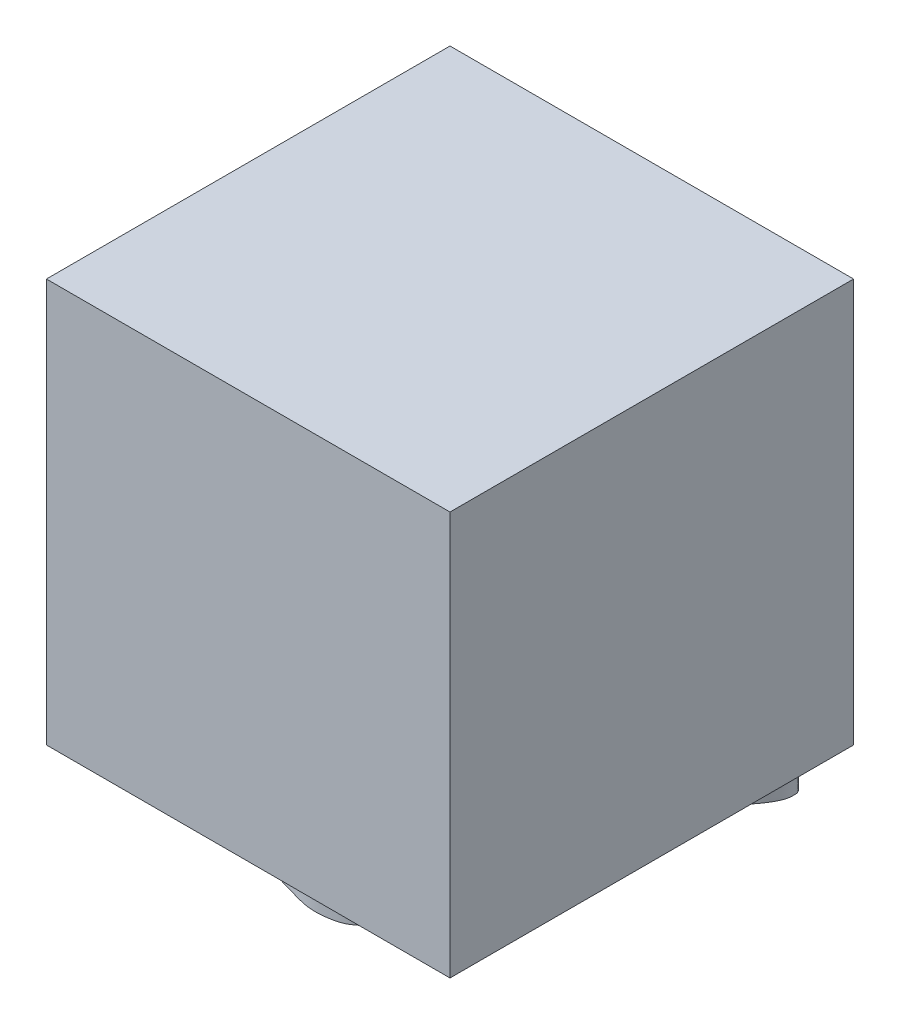
from build123d import *

# Parameters (mm, degrees)
SKETCH_1_W      = 30
SKETCH_1_H      = 30
EXTRUDE_1_DEPTH = 30
EXTRUDE_2_DEPTH = 2


with BuildPart() as part:
    # 草图1 → 凸台-拉伸1 (new body)
    with BuildSketch(Plane(origin=(0, 0, 0), x_dir=(1, 0, 0), z_dir=(0, 1, 0))):
        Rectangle(SKETCH_1_W, SKETCH_1_H)
    extrude(amount=EXTRUDE_1_DEPTH)

    # 草图2 → 凸台-拉伸2 (add)
    with BuildSketch(Plane.XZ):
        with BuildLine():
            add(Edge.make_bspline(
                [(-0.413139507, 12.660249476), (-0.778261096, 12.490955268), (-1.775190195, 11.968904426), (-3.617645227, 11.620705906), (-5.429874837, 11.07144813), (-6.717860152, 10.852505359), (-7.535830981, 11.0254314), (-7.924903013, 10.400481393), (-7.477306177, 9.706186914), (-7.384668414, 8.843700973), (-6.873971011, 7.869907633), (-7.160319356, 6.875523209), (-7.294004446, 5.704246833), (-7.421277648, 4.264169233), (-7.707467224, 2.062321345), (-8.464152297, -1.216837427), (-9.416270532, -4.964154879), (-11.175158435, -8.955848582), (-12.277523791, -11.407219371), (-14.050084255, -12.485011226), (-13.933043988, -12.779768339), (-13.744557421, -12.97250106), (-13.393667558, -12.986420113), (-12.873741383, -12.899604139), (-12.116553141, -12.860937947), (-11.452310478, -12.244644168), (-10.31472738, -11.595554765), (-9.299136585, -10.156201929), (-7.986863801, -8.015821769), (-6.57297794, -5.258138303), (-5.831005868, -2.127270842), (-5.021884261, 0.004287598), (-4.933731925, 1.059336537), (-4.826706465, 1.323611228), (-4.598443234, 1.437232013), (-4.288250478, 1.411645284), (-3.943360214, 1.324520016), (-3.423001508, 1.180348592), (-3.246030566, 0.412709608), (-3.327881363, -0.300948231), (-3.356625482, -1.256490572), (-3.332595796, -2.551860981), (-3.602712128, -4.207022278), (-3.840098598, -5.835024868), (-4.219266493, -7.412610964), (-4.242330279, -8.915857407), (-4.369111397, -10.641593174), (-3.65190849, -11.990229453), (-2.809848226, -12.969581743), (-1.809625327, -13.637359623), (-0.496248558, -14.017074175), (0.567461897, -13.370260365), (1.628053828, -12.925543641), (1.467709085, -11.8264544), (2.274562545, -11.231570985), (2.771920695, -10.368096577), (3.447723159, -9.538536039), (3.982566975, -8.502186189), (4.518942407, -7.551184452), (4.693569353, -6.852226616), (5.043758211, -6.296560663), (5.437210276, -6.755476757), (5.784275685, -7.159692505), (6.647106622, -7.855017156), (7.829613196, -8.76416631), (9.359437859, -9.862540225), (11.028167704, -10.92694032), (12.388237014, -11.697156931), (13.365252981, -12.178241135), (13.976813354, -12.054218893), (14.040955189, -11.439090613), (13.915520663, -10.789468662), (13.486146081, -10.069138366), (13.018870968, -9.363649713), (11.835939267, -8.555574207), (10.566078631, -7.923630982), (9.100096794, -7.040043518), (8.006972881, -6.471280922), (6.789728892, -5.880491964), (6.126347212, -5.361075412), (4.959389532, -5.192703557), (5.479367745, -4.663759847), (5.970560699, -4.32460495), (6.897554288, -3.673930211), (7.997369225, -3.027373773), (9.030812636, -2.00935725), (9.897572996, -0.733261854), (10.499725939, 0.689215867), (9.895977969, 1.894282537), (9.032794377, 2.262260531), (8.046405185, 2.524690213), (7.057401257, 2.581932255), (6.247565966, 2.077763608), (5.74833638, 1.875059682), (5.152031714, 1.641911431), (5.633877884, 1.273737748), (5.975235716, 1.52898326), (6.34735299, 1.556525328), (6.709283818, 1.602138733), (7.071938285, 1.325080522), (7.154943666, 0.781921106), (7.042925909, 0.30981302), (6.541281332, -0.446338426), (5.521793312, -1.075977418), (3.942896108, -2.089511767), (1.89707893, -3.167996126), (0.876238832, -3.368522062), (-0.422809067, -4.163002543), (-0.404542403, -3.87710227), (-0.803217489, -3.897289846), (-0.656049428, -3.576177333), (-0.714875183, -3.323507322), (-0.661354465, -3.021910676), (-0.666268065, -2.724403129), (-0.635125688, -2.376489367), (-0.703207239, -1.916544564), (-0.553324851, -1.410460204), (-0.739968821, -0.95013231), (-1.049137571, -0.433243486), (-1.260611128, 0.140020331), (-1.737553109, 0.610160501), (-2.031039017, 0.865178836), (-2.373543564, 0.999871969), (-2.380434771, 1.173000051), (-2.320724314, 1.31534508), (-2.052318002, 1.451602543), (-1.654877459, 1.494445113), (-1.238579515, 1.722878478), (-0.739146377, 1.813731033), (-0.270028582, 2.002120631), (0.243788374, 2.099306526), (0.826781083, 2.24466196), (1.613408038, 2.448291354), (2.618971353, 2.768447231), (3.983058836, 3.11275807), (5.59477303, 3.488219753), (7.122845708, 3.872937214), (8.504621829, 3.879564133), (9.252468882, 4.222641343), (9.866574989, 4.446828975), (9.919854908, 4.72296331), (9.771305632, 4.930917443), (9.52654699, 5.097217777), (9.173524259, 5.495610484), (8.555844613, 5.570095588), (7.892411431, 5.897522895), (6.976885941, 5.890709642), (6.074067802, 6.16275076), (5.283495217, 5.766787087), (4.601169154, 5.761989446), (3.679753202, 5.284922821), (2.641788543, 5.12866473), (1.242488794, 4.623993771), (0.013157214, 4.469816859), (-1.20124589, 3.953506124), (-2.192760949, 3.768000087), (-3.125774741, 3.36322373), (-3.773007457, 3.139081911), (-4.121562022, 3.058967527), (-4.259342576, 3.119080471), (-4.355820286, 3.211495205), (-4.448304693, 3.355017291), (-4.45471175, 3.667676474), (-4.477622379, 4.084730178), (-4.364277115, 4.603350313), (-4.374550283, 5.114969803), (-4.27557901, 5.624383048), (-4.207873507, 6.050972601), (-4.089449768, 6.292778489), (-4.067235965, 6.454201992), (-3.961381674, 6.442580572), (-3.788052058, 6.535547523), (-3.541718758, 6.385410503), (-3.218718969, 6.449186679), (-2.910839141, 6.256546464), (-2.485550157, 6.372781007), (-2.071071829, 6.188271877), (-1.636090735, 6.250606578), (-1.200782155, 6.163446555), (-0.657565868, 6.058245847), (0.029757843, 6.068779058), (0.790437633, 6.1634305), (1.786272463, 6.242867945), (3.291175791, 6.406836637), (5.540688758, 6.817070819), (7.620485762, 7.466863799), (8.674422461, 8.484669317), (8.775962223, 8.968671554), (8.589535538, 9.200615937), (8.351140841, 9.514736892), (7.916875238, 9.882267546), (7.294816123, 10.060486364), (6.398934994, 10.237318084), (5.341335365, 10.132980834), (3.915068945, 9.915091235), (2.096978192, 9.254612397), (0.06971382, 8.382654832), (-1.914076049, 7.903639645), (-3.015040534, 7.529846337), (-3.691385789, 7.420020544), (-3.951804349, 7.631280816), (-4.078454067, 7.846192489), (-4.167051414, 8.159754439), (-4.183663808, 8.513669074), (-4.21126222, 8.92394897), (-4.225677442, 9.380793519), (-4.562467322, 9.671047371), (-4.810469436, 9.879598003), (-4.973547655, 10.032225982), (-4.947277714, 10.292295204), (-4.61635402, 10.332982338), (-4.210054612, 10.193217911), (-3.69657785, 10.106129644), (-3.188153602, 10.0012354), (-2.663481676, 9.909369761), (-1.652809502, 9.801554359), (-0.477186979, 9.896369339), (0.933586865, 10.140283458), (2.208260982, 10.491377912), (4.02001539, 10.857230536), (5.483352038, 11.41556514), (6.469020229, 12.326193463), (6.387698048, 12.858929054), (6.035914881, 13.15342118), (5.495181719, 13.495497514), (4.502482332, 13.720454343), (3.055509861, 13.809807787), (1.594209656, 13.301654653), (0.36951905, 13.004085061), (-0.2040422, 12.75720064), (-0.413139507, 12.660249476)],
                knots=[0, 0, 0, 0, 0.005626061, 0.015694521, 0.026033351, 0.032086213, 0.034130702, 0.036852638, 0.039956627, 0.044843127, 0.049045535, 0.054701236, 0.05851792, 0.065709321, 0.074889623, 0.089625909, 0.11279458, 0.129064012, 0.150062865, 0.152160336, 0.153130122, 0.153997525, 0.155862947, 0.157612747, 0.161562635, 0.165985541, 0.169813161, 0.179891994, 0.189850356, 0.205303502, 0.222860236, 0.234937007, 0.236802428, 0.237716751, 0.238769217, 0.240098134, 0.24198306, 0.243862434, 0.247165407, 0.251460051, 0.25432416, 0.26045848, 0.269625682, 0.277709174, 0.283543137, 0.292253836, 0.298797, 0.307350322, 0.312707118, 0.316761448, 0.324279638, 0.329823371, 0.334220211, 0.338390167, 0.342748815, 0.347145655, 0.352421863, 0.357595066, 0.363629773, 0.367027872, 0.368836407, 0.370513013, 0.373552364, 0.377178091, 0.38556112, 0.394723191, 0.403457252, 0.413296854, 0.416626611, 0.418663418, 0.42067181, 0.424201146, 0.428133799, 0.432222777, 0.435943803, 0.447938526, 0.452198969, 0.459835758, 0.465506221, 0.470215208, 0.473964213, 0.475273324, 0.478769939, 0.48310816, 0.490763399, 0.496763374, 0.503086434, 0.51285569, 0.515736172, 0.521048894, 0.525164618, 0.530276863, 0.534346629, 0.537688915, 0.539163217, 0.540904037, 0.542912429, 0.544677097, 0.546108239, 0.547866975, 0.550395868, 0.553346244, 0.554482954, 0.563033068, 0.569415346, 0.58157619, 0.591427608, 0.593423505, 0.593525729, 0.595227083, 0.596044986, 0.597436626, 0.59896408, 0.600224639, 0.601617422, 0.603837797, 0.606686446, 0.608648943, 0.610550576, 0.615192323, 0.616985243, 0.619773525, 0.620956421, 0.621380126, 0.622050062, 0.623014616, 0.625368995, 0.627646884, 0.629532091, 0.632441851, 0.634692888, 0.636840972, 0.640861668, 0.646072993, 0.651619616, 0.660564653, 0.66925972, 0.673692486, 0.679503508, 0.681144846, 0.682039979, 0.68298464, 0.684524158, 0.686217765, 0.690240174, 0.692689678, 0.696495613, 0.702923448, 0.704934653, 0.708582735, 0.712218307, 0.719226501, 0.723148425, 0.733024003, 0.736362109, 0.741561127, 0.747078169, 0.750496328, 0.75127615, 0.751943279, 0.752491206, 0.753144534, 0.754270181, 0.756747835, 0.759029809, 0.761635951, 0.763861104, 0.766340307, 0.767486222, 0.767848724, 0.768292157, 0.768683909, 0.770593572, 0.771615605, 0.773173094, 0.775279101, 0.777368647, 0.779257858, 0.781290158, 0.783550806, 0.787005067, 0.790847073, 0.794298741, 0.800998796, 0.812023881, 0.826485034, 0.830625387, 0.83183958, 0.832854077, 0.834571205, 0.837478163, 0.840563595, 0.843522065, 0.850248481, 0.855243314, 0.863744527, 0.877181842, 0.886230424, 0.892016225, 0.893905691, 0.895212712, 0.896407795, 0.897377826, 0.899744602, 0.901326837, 0.903205867, 0.905863036, 0.907048853, 0.90784209, 0.908906419, 0.909808298, 0.911922033, 0.915086655, 0.917012076, 0.919211648, 0.922542977, 0.931228585, 0.935602937, 0.942595007, 0.949759897, 0.96132567, 0.965074835, 0.966425798, 0.9683114, 0.971221463, 0.975413393, 0.982347941, 0.99126828, 0.996778076, 1, 1, 1, 1], degree=3))
        make_face()
        with BuildLine():
            add(Edge.make_bspline(
                [(-0.693798197, -4.734234947), (-0.673202966, -4.947364787), (-0.8703055, -5.395046404), (-1.090680116, -6.103168948), (-1.183071409, -6.887176425), (-1.422671576, -7.525292604), (-1.618670167, -8.333397597), (-1.733850353, -9.090489463), (-1.829095006, -9.891496048), (-1.385641931, -10.212209656), (-0.932232823, -10.185050191), (-0.380173422, -9.863558948), (0.281819118, -9.33827611), (1.172532967, -8.767822823), (1.948358517, -7.958852248), (2.795438073, -7.123627641), (3.330619491, -6.447383539), (4.058698458, -5.777599695), (3.681407256, -5.464675377), (3.288213323, -5.093267728), (2.558521405, -4.929023165), (1.64960004, -4.767066453), (0.836827753, -4.774856286), (0.069966533, -4.642824403), (-0.324513279, -4.5713946), (-0.735566967, -4.500842728), (-0.699493546, -4.675296591), (-0.693798197, -4.734234947)],
                knots=[0, 0, 0, 0, 0.03186058, 0.085166108, 0.122785754, 0.164529652, 0.199659176, 0.26155701, 0.300500202, 0.319029188, 0.345859822, 0.371947615, 0.425742909, 0.488581098, 0.548726468, 0.615853875, 0.680887578, 0.720205924, 0.731599833, 0.755652369, 0.813703951, 0.850500081, 0.912215183, 0.951809616, 0.975379439, 0.991189361, 1, 1, 1, 1], degree=3))
        make_face(mode=Mode.SUBTRACT)
    extrude(amount=EXTRUDE_2_DEPTH)


solid = part.part
